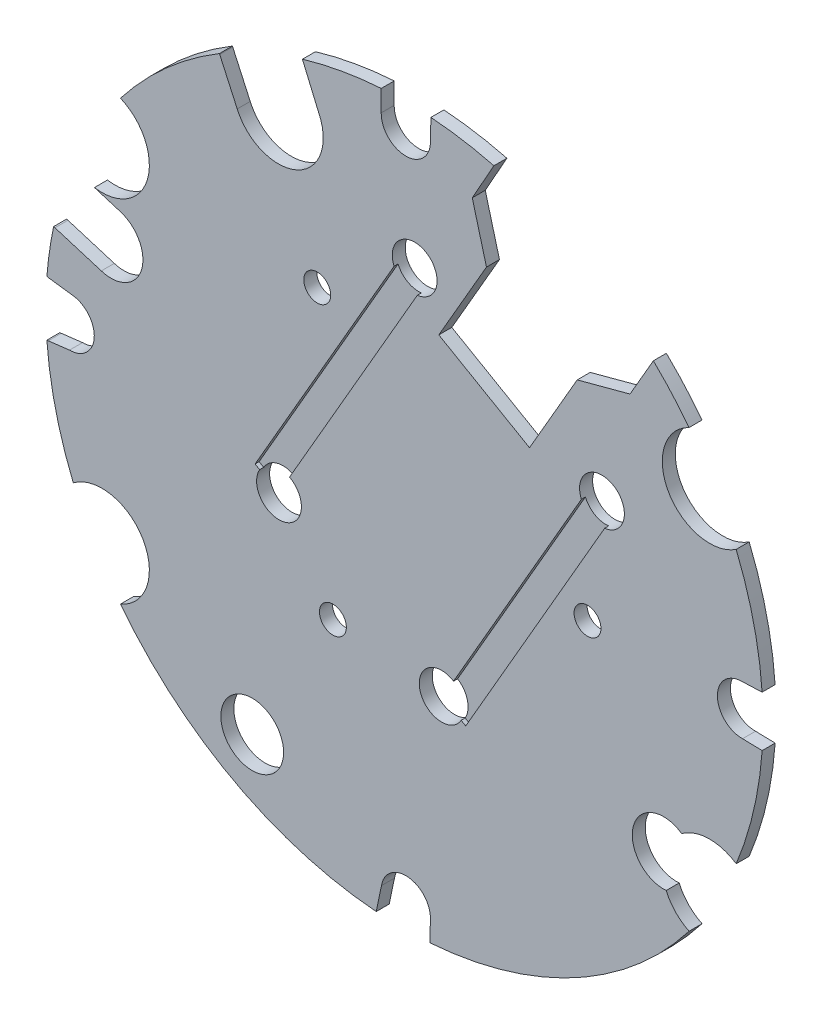
from build123d import *
from build123d.topology import SkipClean

# Parameters (mm, degrees)
SZKIC1_R                    = 3
DODANIE_WYCI_GNI_CIE1_DEPTH = 2.9
CUT_EXTRUDE1_DEPTH          = 114.129457027
BOSS_EXTRUDE1_START         = -2
BOSS_EXTRUDE1_DEPTH         = 2
SKETCH4_R                   = 7
CUT_EXTRUDE2_DEPTH          = 114.129457027


with BuildPart() as part:
    # Szkic1 → Dodanie-wyciągnięcie1 (new body)
    with BuildSketch(Plane.XY):
        with BuildLine():
            Line((5.59608992, 79.7936944), (5.474471245, 74.546001301))
            ThreePointArc((5.474471245, 74.546001301), (-0.291440696, 69.526456585), (-5.49285922, 75.12885027))
            Line((-5.49285922, 75.12885027), (-5.49285922, 79.844283988))
            ThreePointArc((-5.49285922, 79.844283988), (-14.367089706, 78.768108258), (-23.065888919, 76.708736224))
            Line((-23.065888919, 76.708736224), (-23.039986666, 76.621411569))
            Line((-23.039986666, 76.621411569), (-19.411565048, 68.127477703))
            ThreePointArc((-19.411565048, 68.127477703), (-24.281118736, 54.694699487), (-37.616696357, 59.824461002))
            Line((-37.616696357, 59.824461002), (-41.525713683, 68.39534268))
            Line((-41.525713683, 68.39534268), (-41.581780451, 68.547753974))
            ThreePointArc((-41.581780451, 68.547753974), (-53.538529253, 59.740594559), (-63.661784759, 48.875531428))
            ThreePointArc((-63.661784759, 48.875531428), (-57.63860389, 36.215421703), (-69.476005411, 28.703230861))
            Line((-69.476005411, 28.703230861), (-63.782348494, 26.96242314))
            ThreePointArc((-63.782348494, 26.96242314), (-58.970954639, 18.052629351), (-67.944384326, 13.360988291))
            Line((-67.944384326, 13.360988291), (-78.286081853, 16.522911699))
            Line((-78.286081853, 16.522911699), (-78.582583175, 16.605553861))
            ThreePointArc((-78.582583175, 16.605553861), (-79.500655067, 11.453666872), (-80.079993893, 6.252785978))
            Line((-80.079993893, 6.252785978), (-79.77300326, 6.154050162))
            Line((-79.77300326, 6.154050162), (-74.677344042, 5.483608926))
            ThreePointArc((-74.677344042, 5.483608926), (-69.513002092, -0.180404237), (-75.038066691, -5.493137439))
            Line((-75.038066691, -5.493137439), (-79.77687053, -6.060366735))
            Line((-79.77687053, -6.060366735), (-80.092161675, -6.095570053))
            ThreePointArc((-80.092161675, -6.095570053), (-78.122473499, -18.642914619), (-74.192138812, -30.72049701))
            ThreePointArc((-74.192138812, -30.72049701), (-58.652296854, -33.838462178), (-63.661783627, -48.875530946))
            ThreePointArc((-63.661783627, -48.875530946), (-38.402330015, -70.364141863), (-6.599369234, -79.764784472))
            Line((-6.599369234, -79.764784472), (-6.599369234, -79.734091682))
            Line((-6.599369234, -79.734091682), (-5.427735296, -74.153881943))
            ThreePointArc((-5.427735296, -74.153881943), (0.501919726, -69.539966289), (5.491002421, -75.157624183))
            Line((5.491002421, -75.157624183), (5.357427391, -79.811006311))
            ThreePointArc((5.357427391, -79.811006311), (37.621821152, -70.448066311), (63.198431202, -48.665211389))
            ThreePointArc((63.198431202, -48.665211389), (58.631189133, -33.87502124), (73.70968686, -30.375259673))
            ThreePointArc((73.70968686, -30.375259673), (77.597084263, -18.221882556), (79.503058016, -5.605080347))
            Line((79.503058016, -5.605080347), (75.132623878, -5.498149954))
            ThreePointArc((75.132623878, -5.498149954), (69.518937549, -0.057178034), (75.019100209, 5.498527174))
            Line((75.019100209, 5.498527174), (79.497785184, 5.679667972))
            ThreePointArc((79.497785184, 5.679667972), (77.588561718, 18.258285206), (73.709687487, 30.375260095))
            ThreePointArc((73.709687487, 30.375260095), (58.631189019, 33.875021437), (63.198432292, 48.665211915))
            ThreePointArc((63.198432292, 48.665211915), (59.384670175, 53.274660922), (55.237154752, 57.586263576))
            Line((55.237154752, 57.586263576), (50.019107731, 48.548341019))
            Line((50.019107731, 48.548341019), (38.235772571, 45.391005879))
            Line((38.235772571, 45.391005879), (27.597522321, 26.965015942))
            Line((27.597522321, 26.965015942), (7.360240685, 38.649015942))
            Line((7.360240685, 38.649015942), (17.993490945, 57.066345642))
            Line((17.993490945, 57.066345642), (14.823837521, 68.868339749))
            Line((14.823837521, 68.868339749), (19.653558746, 77.480969916))
            ThreePointArc((19.653558746, 77.480969916), (12.67640031, 78.950827209), (5.59608992, 79.7936944))
        make_face()
        with Locations((-16.270008662, -28.180480518)):
            Circle(SZKIC1_R, mode=Mode.SUBTRACT)
        with Locations((40.540020027, 1.11e-07)):
            Circle(SZKIC1_R, mode=Mode.SUBTRACT)
        with Locations((-19.770010135, 34.242663145)):
            Circle(SZKIC1_R, mode=Mode.SUBTRACT)
    extrude(amount=DODANIE_WYCI_GNI_CIE1_DEPTH)

    # Sketch2 → Cut-Extrude1 (cut, through all)
    with BuildSketch(Plane.XY.offset(2.9)):
        with BuildLine():
            Line((44.364070916, 19.778823857), (13.364070916, -33.914751178))
            Line((13.364070916, -33.914751178), (12.3463525, -33.327171176))
            ThreePointArc((12.3463525, -33.327171176), (3.149700914, -32.090654364), (10.646386774, -26.62191819))
            Line((10.646386774, -26.62191819), (39.167918493, 22.778823857))
            ThreePointArc((39.167918493, 22.778823857), (46.265994705, 29.073052491), (44.364070916, 19.778823857))
        make_face()
        with BuildLine():
            Line((-33.626467493, -6.784751178), (-32.612602806, -7.378895826))
            ThreePointArc((-32.612602806, -7.378895826), (-26.935905927, -14.717570636), (-25.95184679, -5.49191819))
            Line((-25.95184679, -5.49191819), (2.569684929, 43.908823857))
            ThreePointArc((2.569684929, 43.908823857), (4.471608718, 53.203052491), (-2.626467493, 46.908823857))
            Line((-2.626467493, 46.908823857), (-33.626467493, -6.784751178))
        make_face()
    extrude(amount=-CUT_EXTRUDE1_DEPTH, mode=Mode.SUBTRACT)

    # Sketch3 → Boss-Extrude1 (add)
    with SkipClean():  # the faces are left unmerged after this step: merging them gives an invalid solid
        with BuildSketch(Plane(origin=(0, 0, 0), x_dir=(-1, 0, 0), z_dir=(0, 0, -1)).offset(BOSS_EXTRUDE1_START)):
            with BuildLine():
                Line((2.626467493, 46.908823857), (33.626467493, -6.784751178))
                Line((33.626467493, -6.784751178), (32.612602806, -7.378895826))
                ThreePointArc((32.612602806, -7.378895826), (29.661615324, -5.096213752), (25.95184679, -5.49191819))
                Line((25.95184679, -5.49191819), (-2.569684929, 43.908823857))
                ThreePointArc((-2.569684929, 43.908823857), (0.528391282, 44.542798453), (2.626467493, 46.908823857))
            make_face()
            with BuildLine():
                Line((-39.167918493, 22.778823857), (-10.646386774, -26.62191819))
                ThreePointArc((-10.646386774, -26.62191819), (-12.843027181, -29.633130023), (-12.3463525, -33.327171176))
                Line((-12.3463525, -33.327171176), (-13.364070916, -33.914751178))
                Line((-13.364070916, -33.914751178), (-44.364070916, 19.778823857))
                ThreePointArc((-44.364070916, 19.778823857), (-41.265994705, 20.412798453), (-39.167918493, 22.778823857))
            make_face()
        extrude(amount=BOSS_EXTRUDE1_DEPTH)

    # Sketch4 → Cut-Extrude2 (cut, through all)
    with SkipClean():  # the faces are left unmerged after this step: merging them gives an invalid solid
        with BuildSketch(Plane.XY.offset(2.9)):
            with Locations((-34.270008175, -59.357395336)):
                Circle(SKETCH4_R)
            with Locations((57.524732512, -36.364240597)):
                Circle(SKETCH4_R)
        extrude(amount=-CUT_EXTRUDE2_DEPTH, mode=Mode.SUBTRACT)


solid = part.part
